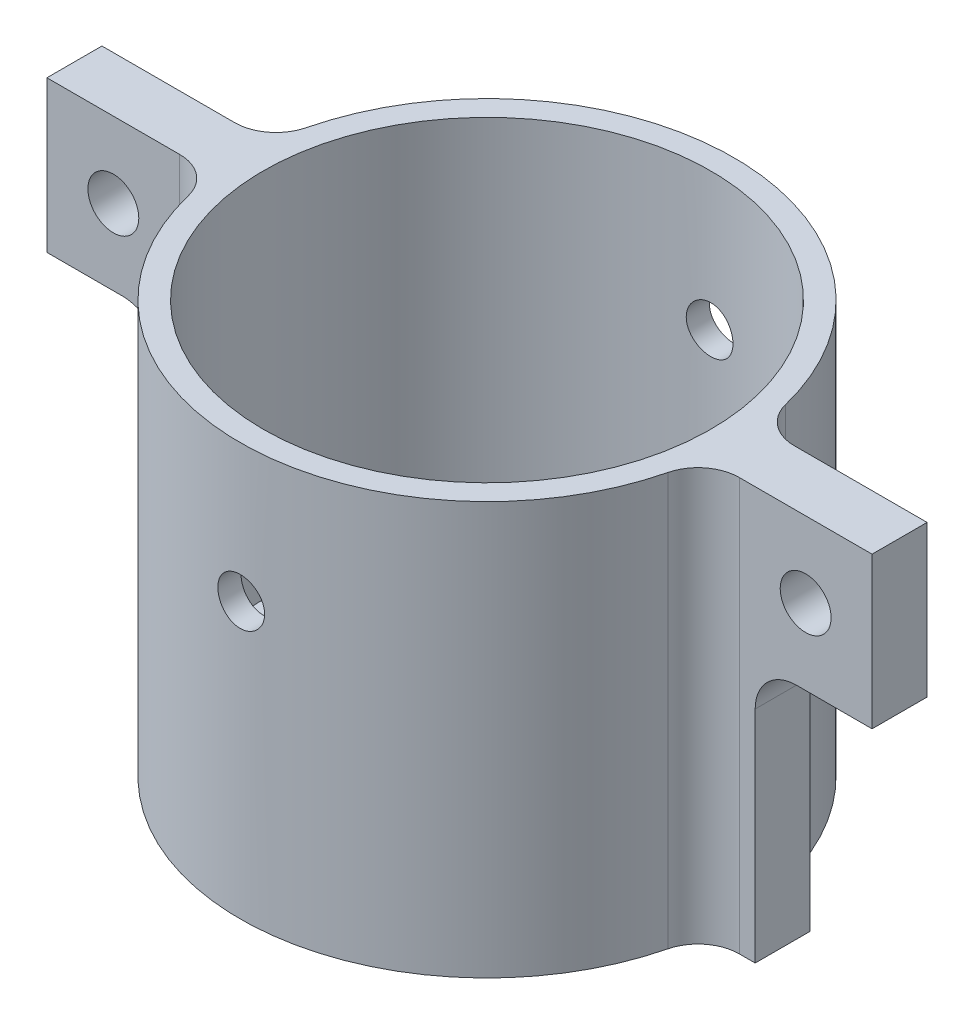
from build123d import *

# Parameters (mm, degrees)
BOSS_EXTRUDE1_DEPTH = 30
SKETCH4_W           = 4
SKETCH4_H           = 19
CUT_EXTRUDE3_DEPTH  = 8.5
SKETCH7_R           = 16.275
CUT_EXTRUDE4_DEPTH  = 27
SKETCH6_R           = 9
CUT_EXTRUDE5_DEPTH  = 4
FILLET3_R           = 3
FILLET4_R           = 3
SKETCH8_R           = 1.85
CUT_EXTRUDE6_DEPTH  = 4
SKETCH9_R           = 1.7
CUT_EXTRUDE7_DEPTH  = 37


with BuildPart() as part:
    # Sketch1 → Boss-Extrude1 (new body)
    with BuildSketch(Plane(origin=(0, 0, 0), x_dir=(1, 0, 0), z_dir=(0, 1, 0))):
        with BuildLine():
            Line((-30, -2), (-30, 2))
            Line((-30, 2), (-17.838231415, 2))
            ThreePointArc((-17.838231415, 2), (0, 17.95), (17.838231415, 2))
            Line((17.838231415, 2), (30, 2))
            Line((30, 2), (30, -2))
            Line((30, -2), (17.838231415, -2))
            ThreePointArc((17.838231415, -2), (0, -17.95), (-17.838231415, -2))
            Line((-17.838231415, -2), (-30, -2))
        make_face()
    extrude(amount=BOSS_EXTRUDE1_DEPTH)

    # Sketch4 → Cut-Extrude3 (cut)
    with BuildSketch(Plane.ZY.offset(30)):
        with Locations((0, 9.5)):
            Rectangle(SKETCH4_W, SKETCH4_H)
    cut_extrude3 = extrude(amount=-CUT_EXTRUDE3_DEPTH, mode=Mode.SUBTRACT)

    # Mirror1: Cut-Extrude3 across plane
    add(cut_extrude3.mirror(Plane(origin=(0, 0, 0), x_dir=(0, 0, 1), z_dir=(1, 0, 0))), mode=Mode.SUBTRACT)

    # Sketch7 → Cut-Extrude4 (cut)
    with BuildSketch(Plane(origin=(0, 30, 0), x_dir=(1, 0, 0), z_dir=(0, 1, 0))):
        with Locations(Location((0, 0, 0), (0, 0, 270))):
            Circle(SKETCH7_R)
    extrude(amount=-CUT_EXTRUDE4_DEPTH, mode=Mode.SUBTRACT)

    # Sketch6 → Cut-Extrude5 (cut)
    with BuildSketch(Plane.XZ):
        with Locations(Location((0, 0, 0), (0, 0, 270))):
            Circle(SKETCH6_R)
    extrude(amount=-CUT_EXTRUDE5_DEPTH, mode=Mode.SUBTRACT)

    # Fillet3
    fillet3_edges = [part.edges().sort_by_distance(p)[0] for p in [
        (-17.838231415, 15, 2),
        (-17.838231415, 15, -2),
        (17.838231415, 15, -2),
        (17.838231415, 15, 2),
    ]]
    fillet(fillet3_edges, radius=FILLET3_R)

    # Fillet4
    fillet4_edges = [part.edges().sort_by_distance(p)[0] for p in [
        (-21.5, 19, 0),
        (21.5, 19, 0),
    ]]
    fillet(fillet4_edges, radius=FILLET4_R)

    # Sketch8 → Cut-Extrude6 (cut)
    with BuildSketch(Plane(origin=(0, 0, -2), x_dir=(-1, 0, 0), z_dir=(0, 0, -1))):
        with Locations((-25.17, 24.5)):
            Circle(SKETCH8_R)
        with Locations(Location((25.17, 24.5, 0), (0, 0, 180))):
            Circle(SKETCH8_R)
    extrude(amount=-CUT_EXTRUDE6_DEPTH, mode=Mode.SUBTRACT)

    # Sketch9 → Cut-Extrude7 (cut)
    with BuildSketch(Plane(origin=(0, 0, -17.95), x_dir=(-1, 0, 0), z_dir=(0, 0, -1))):
        with Locations((0, 20)):
            Circle(SKETCH9_R)
    extrude(amount=-CUT_EXTRUDE7_DEPTH, mode=Mode.SUBTRACT)


solid = part.part
